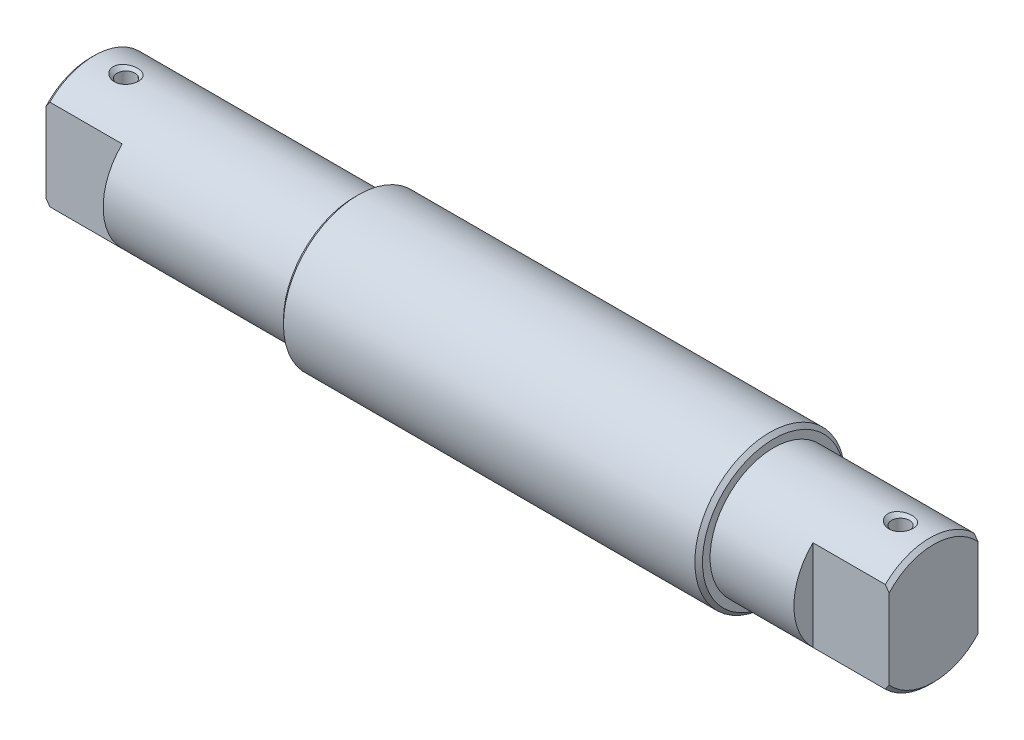
from build123d import *

# Parameters (mm, degrees)
CUT_EXTRUDE_1_DEPTH      = 192.109261942
CUT_EXTRUDE_1_DEPTH_BACK = 192.109261942
SKETCH_2_W               = 30
SKETCH_2_H               = 7.5
CHAMFER_1_SIZE           = 1.5
M8X1_01_D                = 7
M8X1_01_DEPTH            = 20
M8X1_01_CSINK_D          = 10
M8X1_01_CSINK_ANGLE      = 90
M8X1_01_TIP              = 2.103012167


with BuildPart() as part:
    # Эскиз1 → Повернуть1 (revolve)
    with BuildSketch(Plane.XY, mode=Mode.PRIVATE) as revolve_1_sk:
        Polygon((-186.5, 0), (-186.5, 25), (-82.5, 25), (-82.5, 29.5), (82.5, 29.5), (82.5, 25), (145.5, 25), (145.5, 0), align=None)
    revolve(revolve_1_sk.sketch.rotate(Axis((0, 0, 0), (-1, 0, 0)), 90), axis=Axis((0, 0, 0), (-1, 0, 0)))

    # Эскиз2 → Вырез-Вытянуть1 (cut, two sides: drawn at the far end of the back side and taken through both)
    with BuildSketch(Plane(origin=(0, 0, 0), x_dir=(1, 0, 0), z_dir=(0, 1, 0)).offset(-CUT_EXTRUDE_1_DEPTH_BACK)):
        with Locations((-171.5, 21.25)):
            Rectangle(SKETCH_2_W, SKETCH_2_H)
        with Locations((-171.5, -21.25)):
            Rectangle(SKETCH_2_W, SKETCH_2_H)
        with Locations((130.5, 21.25)):
            Rectangle(SKETCH_2_W, SKETCH_2_H)
        with Locations((130.5, -21.25)):
            Rectangle(SKETCH_2_W, SKETCH_2_H)
    extrude(amount=CUT_EXTRUDE_1_DEPTH + CUT_EXTRUDE_1_DEPTH_BACK, mode=Mode.SUBTRACT)

    # Фаска1
    chamfer_1_edges = [part.edges().sort_by_distance(p)[0] for p in [
        (145.5, 25, 0),
        (145.5, -25, 0),
        (-186.5, 25, 0),
        (-186.5, -25, 0),
        (82.5, 0, 29.5),
        (-82.5, 0, 29.5),
    ]]
    chamfer(chamfer_1_edges, length=CHAMFER_1_SIZE)

    # Отверстие обработанное метчиком M8x1.01
    with Locations(Plane(origin=(-172.5, 25, 0), x_dir=(0, 0, 1), z_dir=(0, 1, 0))):
        with Locations((0, 0), (0, 305)):
            CounterSinkHole(M8X1_01_D / 2, M8X1_01_CSINK_D / 2, depth=M8X1_01_DEPTH, counter_sink_angle=M8X1_01_CSINK_ANGLE)
            with Locations((0, 0, -(M8X1_01_DEPTH + M8X1_01_TIP / 2))):  # 118° drill point
                Cone(0, M8X1_01_D / 2, M8X1_01_TIP, mode=Mode.SUBTRACT)


solid = part.part
